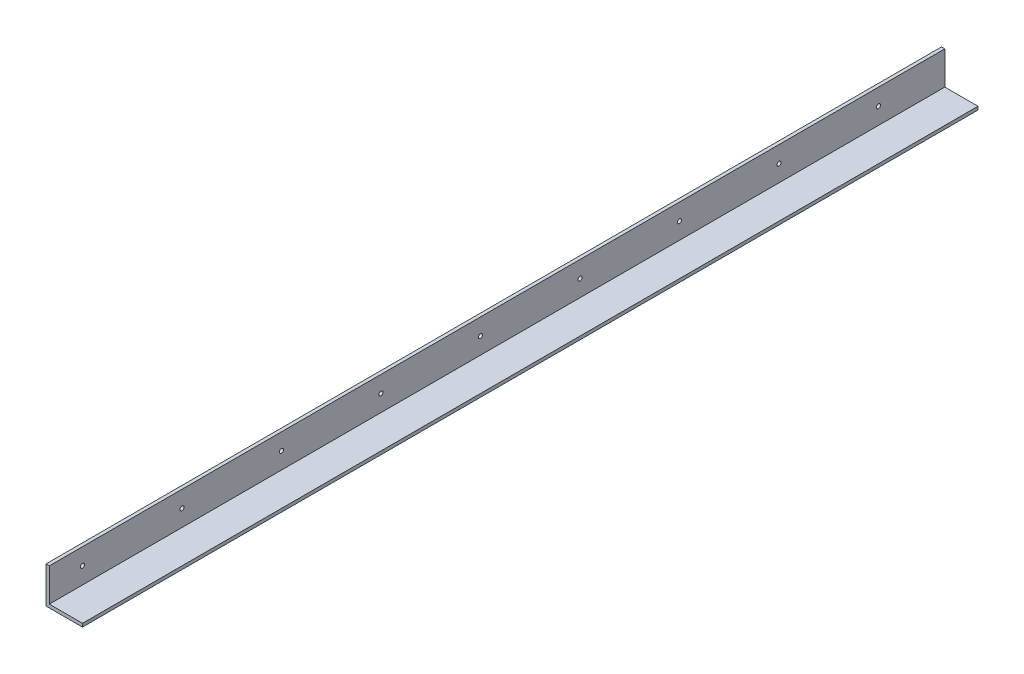
from build123d import *

# Parameters (mm, degrees)
BOSS_EXTRUDE1_DEPTH = 1080
SKETCH2_R           = 2.5
CUT_EXTRUDE1_DEPTH  = 1032.715076947


with BuildPart() as part:
    # Sketch1 → Boss-Extrude1 (new body)
    with BuildSketch(Plane(origin=(0, 0, -50), x_dir=(-1, 0, 0), z_dir=(0, 0, -1))):
        Polygon((0, 44), (-4, 44), (-4, 4), (-44, 4), (-44, 0), (0, 0), align=None)
    extrude(amount=-BOSS_EXTRUDE1_DEPTH)

    # Sketch2 → Cut-Extrude1 (cut, through all)
    with BuildSketch(Plane(origin=(4, 0, 0), x_dir=(0, 0, -1), z_dir=(1, 0, 0))):
        with Locations((-990, 24)):
            Circle(SKETCH2_R)
        with Locations((-870, 24)):
            Circle(SKETCH2_R)
        with Locations((-750, 24)):
            Circle(SKETCH2_R)
        with Locations((-630, 24)):
            Circle(SKETCH2_R)
        with Locations((-510, 24)):
            Circle(SKETCH2_R)
        with Locations((-390, 24)):
            Circle(SKETCH2_R)
        with Locations((-270, 24)):
            Circle(SKETCH2_R)
        with Locations((-150, 24)):
            Circle(SKETCH2_R)
        with Locations((-30, 24)):
            Circle(SKETCH2_R)
    extrude(amount=-CUT_EXTRUDE1_DEPTH, mode=Mode.SUBTRACT)


solid = part.part
